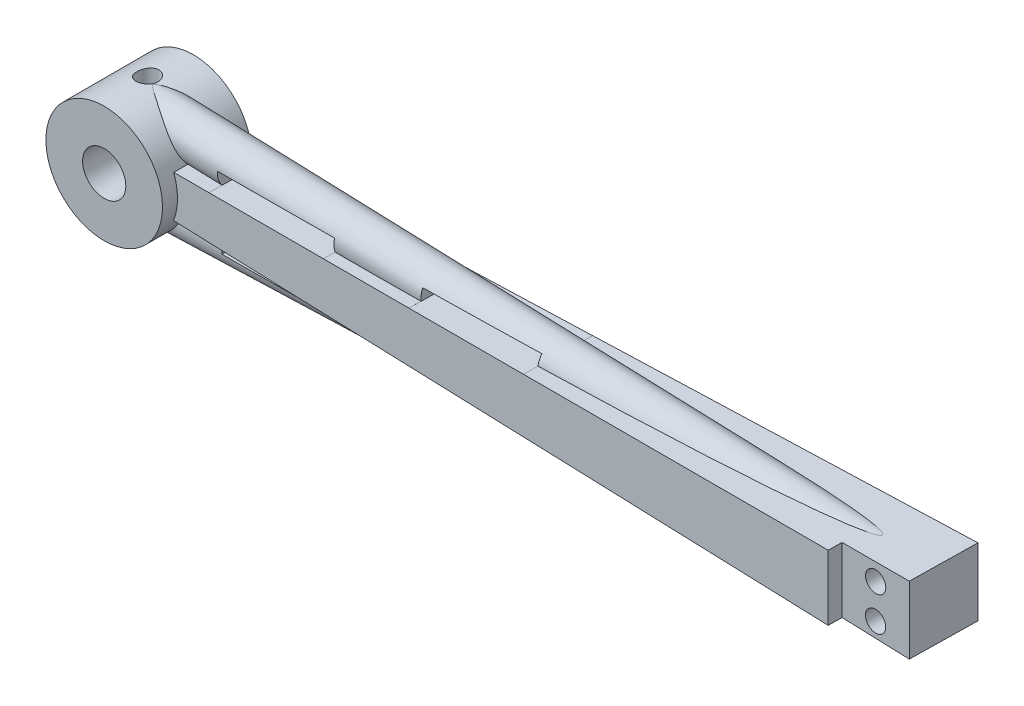
from build123d import *

# Parameters (mm, degrees)
SKETCH2_R           = 8.5
BOSS_EXTRUDE1_DEPTH = 13
SKETCH4_W           = 8
SKETCH4_H           = 6
BOSS_EXTRUDE2_DEPTH = 150
BOSS_EXTRUDE2_DRAFT = -1
SKETCH6_R           = 3
BOSS_EXTRUDE3_DEPTH = 120
SKETCH7_R           = 3
BOSS_EXTRUDE4_DEPTH = 120
CUT_EXTRUDE2_REACH  = 157.776
SKETCH8_R           = 3.15
CUT_EXTRUDE3_REACH  = 157.784
CUT_EXTRUDE6_REACH  = 158.041
SKETCH12_W          = 10
SKETCH12_H          = 2.051798714
CUT_EXTRUDE7_REACH  = 157.784
SKETCH13_W          = 43.706918827
SKETCH13_H          = 28.028328295
SKETCH14_W          = 10
SKETCH14_H          = 13.868841859
CUT_EXTRUDE8_DEPTH  = 2
CUT_EXTRUDE9_REACH  = 118.001
SKETCH15_R          = 1.5
SKETCH16_R          = 1.55
CUT_EXTRUDE10_DEPTH = 10


with BuildPart() as part:
    # Sketch2 → Boss-Extrude1 (new body)
    with BuildSketch(Plane.XY):
        Circle(SKETCH2_R)
    extrude(amount=BOSS_EXTRUDE1_DEPTH)


with BuildPart() as boss_extrude2_tool:
    # Sketch4 → Boss-Extrude2 (with draft: the straight prism first)
    with BuildSketch(Plane(origin=(5, 0, 0), x_dir=(0, 0, -1), z_dir=(1, 0, 0))):
        with Locations((-6.752185146, -0.034660359)):
            Rectangle(SKETCH4_W, SKETCH4_H)
    extrude(amount=BOSS_EXTRUDE2_DEPTH)
    # Boss-Extrude2: the draft: its side faces are tilted about the plane it starts from
    boss_extrude2_sides = [boss_extrude2_tool.faces().sort_by_distance(p)[0] for p in [
        (80, -0.034660359, 10.752185146),
        (80, -3.034660359, 6.752185146),
        (80, -0.034660359, 2.752185146),
        (80, 2.965339641, 6.752185146),
    ]]
    draft(boss_extrude2_sides, Plane(origin=(5, 0, 0), x_dir=(0, 0, -1), z_dir=(1, 0, 0)), BOSS_EXTRUDE2_DRAFT)


with BuildPart() as part_1:
    add(part.part)

    # Boss-Extrude2: add boss_extrude2_tool
    add(boss_extrude2_tool.part)

    # Sketch6 → Boss-Extrude3 (add)
    with BuildSketch(Plane(origin=(0, 0, 0), x_dir=(0, 0, 1), z_dir=(-0.999390827019096, 0.034899496702494044, 0))):
        with Locations((6.68193283, 5.483107785)):
            Circle(SKETCH6_R)
    extrude(amount=-BOSS_EXTRUDE3_DEPTH)

    # Sketch7 → Boss-Extrude4 (add)
    with BuildSketch(Plane(origin=(0, 0, 0), x_dir=(0, 0, 1), z_dir=(0.9993908270190958, 0.034899496702501046, 0))):
        with Locations((6.315850074, 5.431762479)):
            Circle(SKETCH7_R)
    extrude(amount=BOSS_EXTRUDE4_DEPTH)

    # Sketch8 → Cut-Extrude2 (cut, up to next)
    with BuildSketch(Plane.XY.offset(13), mode=Mode.PRIVATE) as cut_extrude2_sk1:
        Circle(SKETCH8_R)
    cut_extrude2_tool1 = extrude(cut_extrude2_sk1.sketch, amount=-CUT_EXTRUDE2_REACH, mode=Mode.PRIVATE) & part_1.part
    add(cut_extrude2_tool1.solids().sort_by_distance((0, 0, 13))[0], mode=Mode.SUBTRACT)

    # Sketch9 → Cut-Extrude3 (cut, up to next)
    with BuildSketch(Plane(origin=(-0.186099993, 0, 10.661661434), x_dir=(0.9998476951563913, 0, 0.01745240643728355), z_dir=(-0.01745240643728355, 0, 0.9998476951563913)), mode=Mode.PRIVATE) as cut_extrude3_sk1:
        Polygon((13.337744906, 3.107591674), (30.337744906, 3.404282584), (30.337744906, 5.218463822), (13.337744906, 5.218463822), align=None)
    cut_extrude3_tool1 = extrude(cut_extrude3_sk1.sketch, amount=-CUT_EXTRUDE3_REACH, mode=Mode.PRIVATE) & part_1.part
    # Sketch9 → Cut-Extrude3 (cut, up to next)
    with BuildSketch(Plane(origin=(-0.186099993, 0, 10.661661434), x_dir=(0.9998476951563913, 0, 0.01745240643728355), z_dir=(-0.01745240643728355, 0, 0.9998476951563913)), mode=Mode.PRIVATE) as cut_extrude3_sk2:
        Polygon((43.018729252, 3.625596277), (60.018729252, 3.922287186), (60.018729252, 5.218463822), (43.018729252, 5.218463822), align=None)
    cut_extrude3_tool2 = extrude(cut_extrude3_sk2.sketch, amount=-CUT_EXTRUDE3_REACH, mode=Mode.PRIVATE) & part_1.part
    # Sketch9 → Cut-Extrude3 (cut, up to next)
    with BuildSketch(Plane(origin=(-0.186099993, 0, 10.661661434), x_dir=(0.9998476951563913, 0, 0.01745240643728355), z_dir=(-0.01745240643728355, 0, 0.9998476951563913)), mode=Mode.PRIVATE) as cut_extrude3_sk3:
        Polygon((13.624548626, -3.181917807), (30.624548626, -3.478608716), (30.624548626, -5.320643976), (13.624548626, -5.320643976), align=None)
    cut_extrude3_tool3 = extrude(cut_extrude3_sk3.sketch, amount=-CUT_EXTRUDE3_REACH, mode=Mode.PRIVATE) & part_1.part
    # Sketch9 → Cut-Extrude3 (cut, up to next)
    with BuildSketch(Plane(origin=(-0.186099993, 0, 10.661661434), x_dir=(0.9998476951563913, 0, 0.01745240643728355), z_dir=(-0.01745240643728355, 0, 0.9998476951563913)), mode=Mode.PRIVATE) as cut_extrude3_sk4:
        Polygon((43.018729252, -3.694916994), (60.018729252, -3.991607903), (60.018729252, -5.320643976), (43.018729252, -5.320643976), align=None)
    cut_extrude3_tool4 = extrude(cut_extrude3_sk4.sketch, amount=-CUT_EXTRUDE3_REACH, mode=Mode.PRIVATE) & part_1.part
    add(cut_extrude3_tool1.solids().sort_by_distance((21.434183, 4.235332, 11.039045))[0], mode=Mode.SUBTRACT)
    add(cut_extrude3_tool2.solids().sort_by_distance((51.033857, 4.493664, 11.555709))[0], mode=Mode.SUBTRACT)
    add(cut_extrude3_tool3.solids().sort_by_distance((21.723939, -4.323611, 11.044103))[0], mode=Mode.SUBTRACT)
    add(cut_extrude3_tool4.solids().sort_by_distance((51.040328, -4.579471, 11.555822))[0], mode=Mode.SUBTRACT)

    # Sketch12 → Cut-Extrude6 (cut, up to next)
    with BuildSketch(Plane(origin=(-0.050221498, 2.877187697, 0), x_dir=(0.9998476951563913, 0.01745240643728355, 0), z_dir=(-0.01745240643728355, 0.9998476951563913, 0)), mode=Mode.PRIVATE) as cut_extrude6_sk1:
        with Locations((141.40635612, -10.3349379)):
            Rectangle(SKETCH12_W, SKETCH12_H)
    cut_extrude6_tool1 = extrude(cut_extrude6_sk1.sketch, amount=-CUT_EXTRUDE6_REACH, mode=Mode.PRIVATE) & part_1.part
    add(cut_extrude6_tool1.solids().sort_by_distance((141.334598, 5.345069, 10.334938))[0], mode=Mode.SUBTRACT)

    # Cut-Extrude7: up to this plane
    cut_extrude7_end = Plane(origin=(5, 2.965339641, 2.752185146), z_dir=(-0.01745240643728355, 0, -0.9998476951563913))
    # Sketch13 → Cut-Extrude7 (cut, up to the surface)
    with BuildSketch(Plane(origin=(-0.186099993, 0, 10.661661434), x_dir=(0.9998476951563913, 0, 0.01745240643728355), z_dir=(-0.01745240643728355, 0, 0.9998476951563913)), mode=Mode.PRIVATE) as cut_extrude7_sk1:
        with Locations((137.063198602, -4.734636569)):
            Rectangle(SKETCH13_W, SKETCH13_H)
    cut_extrude7_tool1 = split(extrude(cut_extrude7_sk1.sketch, amount=-CUT_EXTRUDE7_REACH, mode=Mode.PRIVATE), bisect_by=cut_extrude7_end, keep=Keep.BOTH, mode=Mode.PRIVATE)
    add(cut_extrude7_tool1.solids().sort_by_distance((136.856223, -4.734637, 13.053744))[0], mode=Mode.SUBTRACT)

    # Sketch14 → Cut-Extrude8 (cut)
    with BuildSketch(Plane(origin=(-0.186099993, 0, 10.661661434), x_dir=(0.9998476951563913, 0, 0.01745240643728355), z_dir=(-0.01745240643728355, 0, 0.9998476951563913))):
        with Locations((110.243167646, 0.778255403)):
            Rectangle(SKETCH14_W, SKETCH14_H)
    extrude(amount=-CUT_EXTRUDE8_DEPTH, mode=Mode.SUBTRACT)

    # Sketch15 → Cut-Extrude9 (cut, up to next)
    with BuildSketch(Plane(origin=(-0.15119518, 0, 8.661966044), x_dir=(0.9998476951563913, 0, 0.017452406437283588), z_dir=(-0.017452406437283588, 0, 0.9998476951563913)), mode=Mode.PRIVATE) as cut_extrude9_sk1:
        with Locations((110.220200994, 2.297708244)):
            Circle(SKETCH15_R)
    cut_extrude9_tool1 = extrude(cut_extrude9_sk1.sketch, amount=-CUT_EXTRUDE9_REACH, mode=Mode.PRIVATE) & part_1.part
    # Sketch15 → Cut-Extrude9 (cut, up to next)
    with BuildSketch(Plane(origin=(-0.15119518, 0, 8.661966044), x_dir=(0.9998476951563913, 0, 0.017452406437283588), z_dir=(-0.017452406437283588, 0, 0.9998476951563913)), mode=Mode.PRIVATE) as cut_extrude9_sk2:
        with Locations((110.209739188, -2.702291756)):
            Circle(SKETCH15_R)
    cut_extrude9_tool2 = extrude(cut_extrude9_sk2.sketch, amount=-CUT_EXTRUDE9_REACH, mode=Mode.PRIVATE) & part_1.part
    add(cut_extrude9_tool1.solids().sort_by_distance((110.052219, 2.297708, 10.585574))[0], mode=Mode.SUBTRACT)
    add(cut_extrude9_tool2.solids().sort_by_distance((110.041759, -2.702292, 10.585391))[0], mode=Mode.SUBTRACT)

    # Sketch16 → Cut-Extrude10 (cut, symmetric)
    with BuildSketch(Plane(origin=(0, 0, 0), x_dir=(1, 0, 0), z_dir=(0, 1, 0))):
        with Locations((-0.73595313, -5.950294761)):
            Circle(SKETCH16_R)
    extrude(amount=CUT_EXTRUDE10_DEPTH, both=True, mode=Mode.SUBTRACT)


solid = part_1.part
